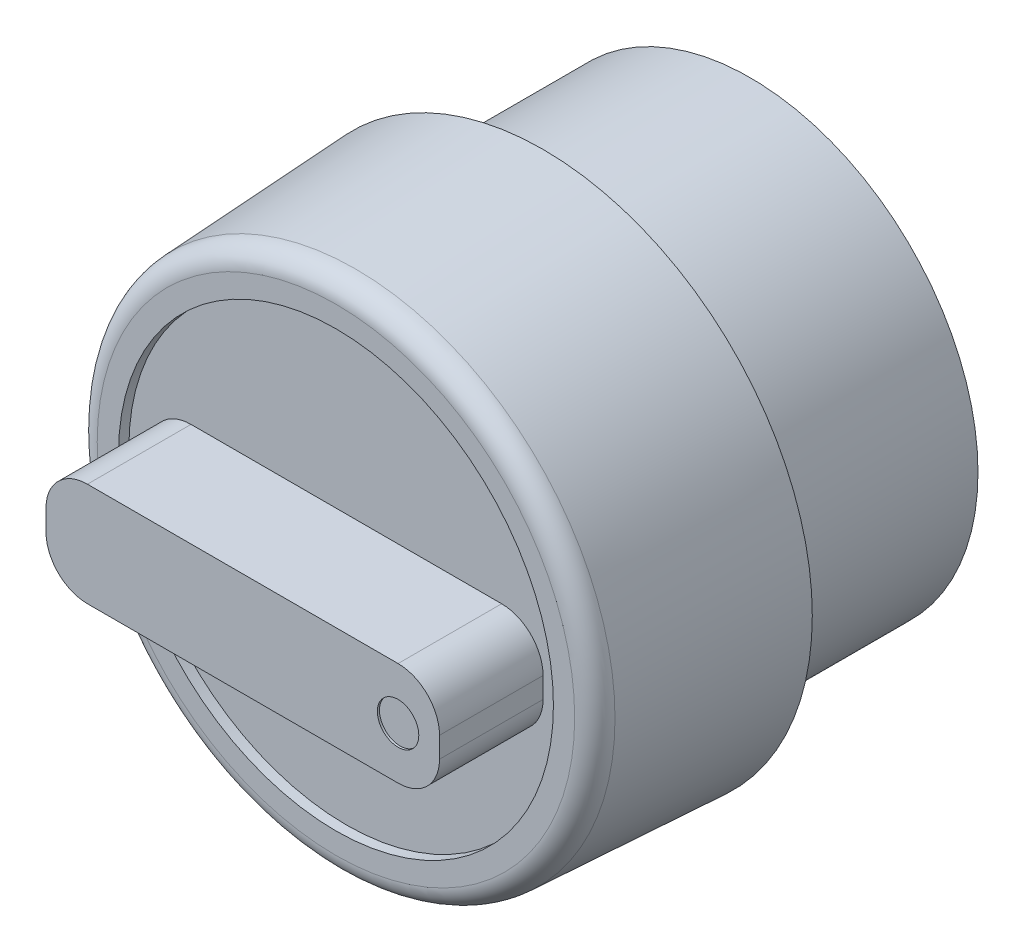
from build123d import *

# Parameters (mm, degrees)
SKETCH_1_R          = 11
EXTRUDE_1_DEPTH     = 10
SKETCH_2_R          = 13
EXTRUDE_2_DEPTH     = 10
EXTRUDE_2_TAPER     = 3
FILLET_1_R          = 1
SKETCH_3_R          = 10.5
CUT_EXTRUDE_1_DEPTH = 0.5
SKETCH_4_W          = 19
SKETCH_4_H          = 5
EXTRUDE_4_DEPTH     = 5
FILLET_3_R          = 2
SKETCH_5_R          = 1
CUT_EXTRUDE_2_DEPTH = 0.1


with BuildPart() as part:
    # 草图1 → 凸台-拉伸1 (new body)
    with BuildSketch(Plane.XY):
        Circle(SKETCH_1_R)
    extrude(amount=EXTRUDE_1_DEPTH)

    # 草图2 → 凸台-拉伸2 (add)
    with BuildSketch(Plane.XY.offset(10)):
        Circle(SKETCH_2_R)
    extrude(amount=EXTRUDE_2_DEPTH, taper=EXTRUDE_2_TAPER)

    # 圆角1
    fillet_1_edges = [part.edges().sort_by_distance(p)[0] for p in [
        (-12.475922207, 0, 20),
    ]]
    fillet(fillet_1_edges, radius=FILLET_1_R)

    # 草图3 → 切除-拉伸1 (cut)
    with BuildSketch(Plane.XY.offset(20)):
        Circle(SKETCH_3_R)
    extrude(amount=-CUT_EXTRUDE_1_DEPTH, mode=Mode.SUBTRACT)

    # 草图4 → 凸台-拉伸4 (add)
    with BuildSketch(Plane.XY.offset(19.5)):
        Rectangle(SKETCH_4_W, SKETCH_4_H)
    extrude(amount=EXTRUDE_4_DEPTH)

    # 圆角3
    fillet_3_edges = [part.edges().sort_by_distance(p)[0] for p in [
        (-9.5, 2.5, 22),
        (-9.5, -2.5, 22),
        (9.5, -2.5, 22),
        (9.5, 2.5, 22),
    ]]
    fillet(fillet_3_edges, radius=FILLET_3_R)

    # 草图5 → 切除-拉伸2 (cut)
    with BuildSketch(Plane.XY.offset(24.5)):
        with Locations((7.5, 0)):
            Circle(SKETCH_5_R)
    extrude(amount=-CUT_EXTRUDE_2_DEPTH, mode=Mode.SUBTRACT)


solid = part.part
